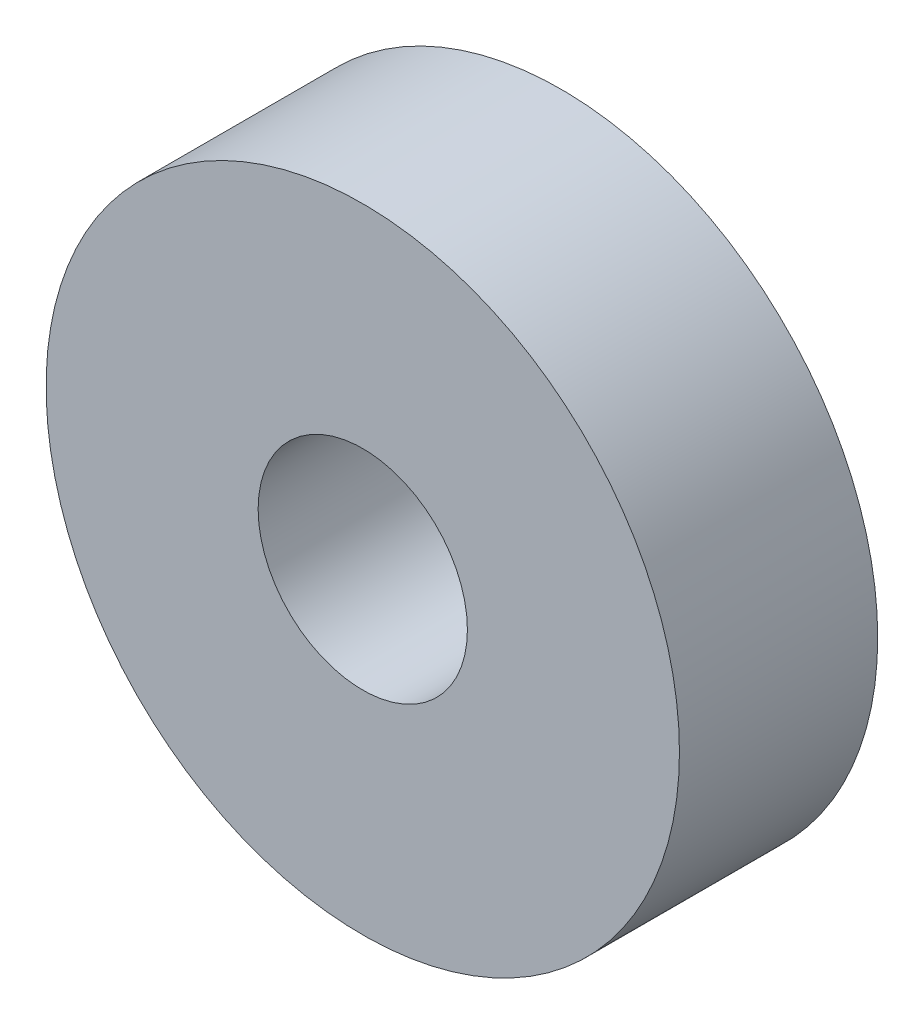
from build123d import *

# Parameters (mm, degrees)
IZIM1_R                     = 11.5
IZIM1_R_2                   = 3.8
Y_KSEKLIK_EKSTR_ZYON1_DEPTH = 7.2


with BuildPart() as part:
    # Çizim1 → Yükseklik-Ekstrüzyon1 (new body)
    with BuildSketch(Plane.XY):
        Circle(IZIM1_R)
        Circle(IZIM1_R_2, mode=Mode.SUBTRACT)
    extrude(amount=Y_KSEKLIK_EKSTR_ZYON1_DEPTH)


solid = part.part
